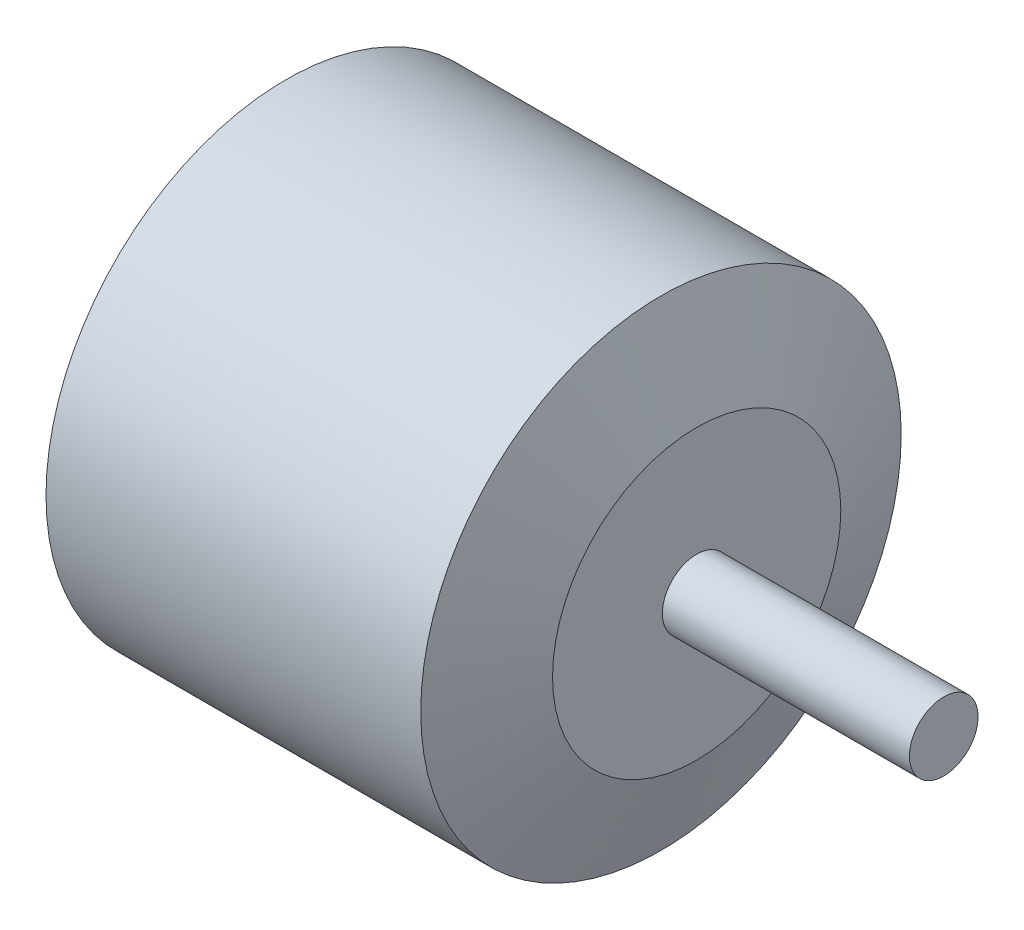
from build123d import *


with BuildPart() as part:
    # Sketch1 → Revolve1 (revolve)
    with BuildSketch(Plane.XY, mode=Mode.PRIVATE) as revolve1_sk:
        Polygon((0, 0), (0, 2.5), (-18, 2.5), (-18, 10.5), (-20.6, 17.5), (-47.9, 17.5), (-50.5, 10.5), (-50.5, 5.5), (-53, 5.5), (-53, 0), align=None)
    revolve(revolve1_sk.sketch.rotate(Axis((-53, 0, 0), (1, 0, 0)), 90), axis=Axis((-53, 0, 0), (1, 0, 0)))


solid = part.part
